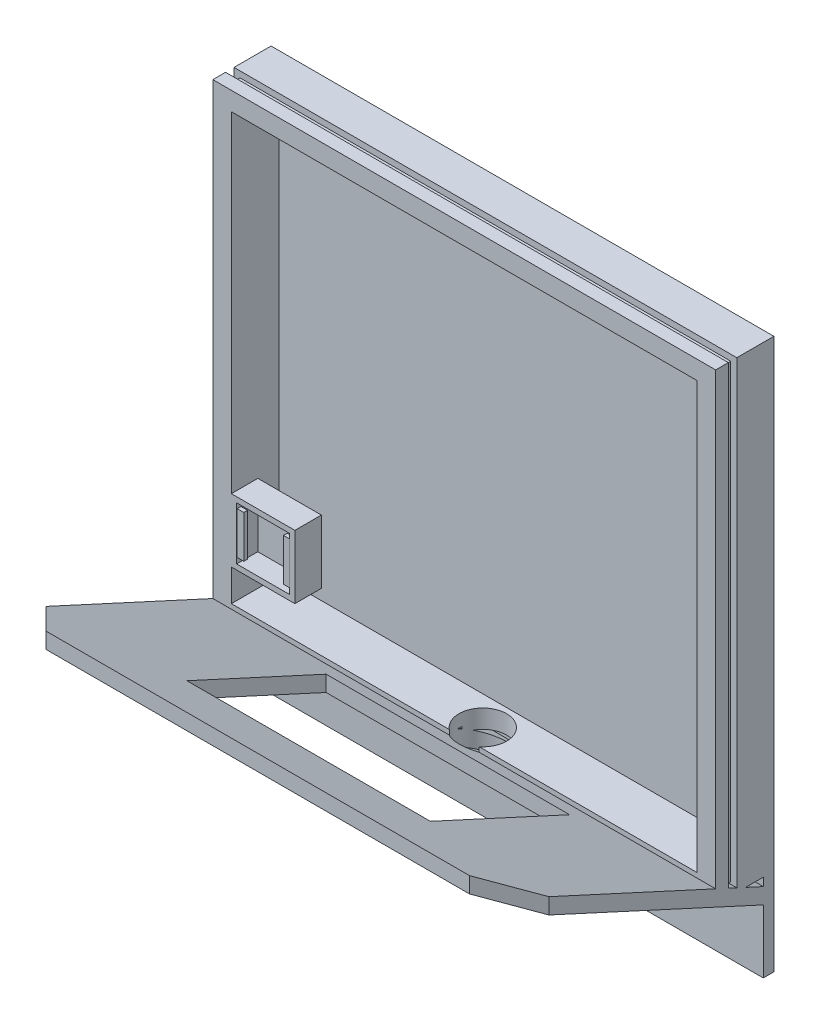
from build123d import *

# Parameters (mm, degrees)
F_190_X_200_TRAY_FLOOR_SKETCH_W                       = 190
F_190_X_200_TRAY_FLOOR_SKETCH_H                       = 208
F_4_MM_TRAY_FLOOR_DEPTH                               = 4
ELECTRONICS_COMPARTMENT_WALL_SKETCH_W                 = 190
ELECTRONICS_COMPARTMENT_WALL_SKETCH_H                 = 175
ELECTRONICS_COMPARTMENT_WALL_SKETCH_W_2               = 176
ELECTRONICS_COMPARTMENT_WALL_SKETCH_H_2               = 161
F_22_MM_PERIMETER_WALLS_DEPTH                         = 22
F_3_2_START                                           = 17.2
EXTERNAL_WALL_CORD_GASKET_GROOVE_SKETCH_W             = 192
EXTERNAL_WALL_CORD_GASKET_GROOVE_SKETCH_H             = 177
EXTERNAL_WALL_CORD_GASKET_GROOVE_SKETCH_W_2           = 185.4
EXTERNAL_WALL_CORD_GASKET_GROOVE_SKETCH_H_2           = 170.4
F_3_2_HIGH_X_2_3_DEEP_EXTERNAL_PERIMETER_G_DEPTH      = 3.2
F_24_MM_GPS_ANTENNA_SHELF_SKETCH_W                    = 24
F_24_MM_GPS_ANTENNA_SHELF_SKETCH_H                    = 24
F_2_MM_GPS_ANTENNA_SHELF_DEPTH                        = 2
F_20_MM_GPS_ANTENNA_GUIDE_RING_SKETCH_W               = 24
F_20_MM_GPS_ANTENNA_GUIDE_RING_SKETCH_H               = 24
F_20_MM_GPS_ANTENNA_GUIDE_RING_SKETCH_W_2             = 20
F_20_MM_GPS_ANTENNA_GUIDE_RING_SKETCH_H_2             = 20
F_8_5_MM_GPS_ANTENNA_GUIDE_RING_DEPTH                 = 8.5
LEFT_GPS_ANTENNA_SNAP_LIP_SKETCH_W                    = 2.5
LEFT_GPS_ANTENNA_SNAP_LIP_SKETCH_H                    = 16
LEFT_GPS_ANTENNA_SNAP_LIP_DEPTH                       = 1.4
RIGHT_GPS_ANTENNA_SNAP_LIP_SKETCH_W                   = 2.5
RIGHT_GPS_ANTENNA_SNAP_LIP_SKETCH_H                   = 16
RIGHT_GPS_ANTENNA_SNAP_LIP_DEPTH                      = 1.4
F_190_MM_WIDE_ANGLED_DISPLAY_BULKHEAD_DEPTH           = 95
F_190_MM_WIDE_ANGLED_DISPLAY_BULKHEAD_DEPTH_BACK      = 95
F_92_X_58_MM_DISPLAY_OPENING_DEPTH                    = 46
F_92_X_58_MM_DISPLAY_OPENING_DEPTH_BACK               = 46
F_18_MM_FRONT_12_V_AND_SENSOR_HARNESS_PASS_DEPTH      = 40
F_18_MM_FRONT_12_V_AND_SENSOR_HARNESS_PASS_DEPTH_BACK = 40
F_18_MM_FRONT_HARNESS_GROMMET_SKETCH_R                = 9
LEFT_SCREEN_HOLDER_CORNER_CHAMFER_DEPTH               = 110
LEFT_SCREEN_HOLDER_CORNER_CHAMFER_DEPTH_BACK          = 110
RIGHT_SCREEN_HOLDER_CORNER_CHAMFER_DEPTH              = 110
RIGHT_SCREEN_HOLDER_CORNER_CHAMFER_DEPTH_BACK         = 110


with BuildPart() as part:
    # 190 x 200 Tray Floor Sketch → 4 mm Tray Floor (new body)
    with BuildSketch(Plane.XY):
        with Locations((0, 96)):
            Rectangle(F_190_X_200_TRAY_FLOOR_SKETCH_W, F_190_X_200_TRAY_FLOOR_SKETCH_H)
    extrude(amount=F_4_MM_TRAY_FLOOR_DEPTH)

    # Electronics Compartment Wall Sketch → 22 mm Perimeter Walls (add)
    with BuildSketch(Plane.XY):
        with Locations((0, 112.5)):
            Rectangle(ELECTRONICS_COMPARTMENT_WALL_SKETCH_W, ELECTRONICS_COMPARTMENT_WALL_SKETCH_H)
        with Locations((0, 112.5)):
            Rectangle(ELECTRONICS_COMPARTMENT_WALL_SKETCH_W_2, ELECTRONICS_COMPARTMENT_WALL_SKETCH_H_2, mode=Mode.SUBTRACT)
    extrude(amount=F_22_MM_PERIMETER_WALLS_DEPTH)

    # External Wall Cord Gasket Groove Sketch → 3.2 High x 2.3 Deep External Perimeter Gasket Groove (cut)
    with BuildSketch(Plane.XY.offset(F_3_2_START)):
        with Locations((0, 112.5)):
            Rectangle(EXTERNAL_WALL_CORD_GASKET_GROOVE_SKETCH_W, EXTERNAL_WALL_CORD_GASKET_GROOVE_SKETCH_H)
        with Locations((0, 112.5)):
            Rectangle(EXTERNAL_WALL_CORD_GASKET_GROOVE_SKETCH_W_2, EXTERNAL_WALL_CORD_GASKET_GROOVE_SKETCH_H_2, mode=Mode.SUBTRACT)
    extrude(amount=-F_3_2_HIGH_X_2_3_DEEP_EXTERNAL_PERIMETER_G_DEPTH, mode=Mode.SUBTRACT)

    # 24 mm GPS Antenna Shelf Sketch → 2 mm GPS Antenna Shelf (add)
    with BuildSketch(Plane.XY.offset(12)):
        with Locations((-76, 56)):
            Rectangle(F_24_MM_GPS_ANTENNA_SHELF_SKETCH_W, F_24_MM_GPS_ANTENNA_SHELF_SKETCH_H)
    extrude(amount=F_2_MM_GPS_ANTENNA_SHELF_DEPTH)

    # 20 mm GPS Antenna Guide Ring Sketch → 8.5 mm GPS Antenna Guide Ring (add)
    with BuildSketch(Plane.XY.offset(13.5)):
        with Locations((-76, 56)):
            Rectangle(F_20_MM_GPS_ANTENNA_GUIDE_RING_SKETCH_W, F_20_MM_GPS_ANTENNA_GUIDE_RING_SKETCH_H)
        with Locations((-76, 56)):
            Rectangle(F_20_MM_GPS_ANTENNA_GUIDE_RING_SKETCH_W_2, F_20_MM_GPS_ANTENNA_GUIDE_RING_SKETCH_H_2, mode=Mode.SUBTRACT)
    extrude(amount=F_8_5_MM_GPS_ANTENNA_GUIDE_RING_DEPTH)

    # Left GPS Antenna Snap Lip Sketch → Left GPS Antenna Snap Lip (add)
    with BuildSketch(Plane.XY.offset(20.4)):
        with Locations((-84.75, 56)):
            Rectangle(LEFT_GPS_ANTENNA_SNAP_LIP_SKETCH_W, LEFT_GPS_ANTENNA_SNAP_LIP_SKETCH_H)
    extrude(amount=LEFT_GPS_ANTENNA_SNAP_LIP_DEPTH)

    # Right GPS Antenna Snap Lip Sketch → Right GPS Antenna Snap Lip (add)
    with BuildSketch(Plane.XY.offset(20.4)):
        with Locations((-67.25, 56)):
            Rectangle(RIGHT_GPS_ANTENNA_SNAP_LIP_SKETCH_W, RIGHT_GPS_ANTENNA_SNAP_LIP_SKETCH_H)
    extrude(amount=RIGHT_GPS_ANTENNA_SNAP_LIP_DEPTH)

    # Angled Display Bulkhead Side Profile → 190 mm Wide Angled Display Bulkhead (add, two sides: drawn at the far end of the back side and taken through both)
    with BuildSketch(Plane(origin=(0, 0, 0), x_dir=(0, 0, -1), z_dir=(1, 0, 0)).offset(-F_190_MM_WIDE_ANGLED_DISPLAY_BULKHEAD_DEPTH_BACK)):
        Polygon((-2, 15), (-2, 21), (-100, 66), (-100, 60), align=None)
    extrude(amount=F_190_MM_WIDE_ANGLED_DISPLAY_BULKHEAD_DEPTH + F_190_MM_WIDE_ANGLED_DISPLAY_BULKHEAD_DEPTH_BACK)

    # 92 x 58 Display Opening Side Profile → 92 x 58 mm Display Opening (cut, two sides: drawn at the far end of the back side and taken through both)
    with BuildSketch(Plane(origin=(0, 0, 0), x_dir=(0, 0, -1), z_dir=(1, 0, 0)).offset(-F_92_X_58_MM_DISPLAY_OPENING_DEPTH_BACK)):
        Polygon((-28.2, 25), (-28.2, 35), (-80.8, 59.2), (-80.8, 49.2), align=None)
    extrude(amount=F_92_X_58_MM_DISPLAY_OPENING_DEPTH + F_92_X_58_MM_DISPLAY_OPENING_DEPTH_BACK, mode=Mode.SUBTRACT)

    # 18 mm Front Harness Grommet Sketch → 18 mm Front 12 V and Sensor Harness Passage (cut, two sides: drawn at the far end of the back side and taken through both)
    with BuildSketch(Plane(origin=(0, 0, 0), x_dir=(1, 0, 0), z_dir=(0, 1, 0)).offset(-F_18_MM_FRONT_12_V_AND_SENSOR_HARNESS_PASS_DEPTH_BACK)):
        with Locations(Location((0, -15, 0), (0, 0, 90))):
            Circle(F_18_MM_FRONT_HARNESS_GROMMET_SKETCH_R)
    extrude(amount=F_18_MM_FRONT_12_V_AND_SENSOR_HARNESS_PASS_DEPTH + F_18_MM_FRONT_12_V_AND_SENSOR_HARNESS_PASS_DEPTH_BACK, mode=Mode.SUBTRACT)

    # Left Screen Holder Corner Chamfer Sketch → Left Screen Holder Corner Chamfer (cut, two sides: drawn at the far end of the back side and taken through both)
    with BuildSketch(Plane(origin=(0, 0, 0), x_dir=(1, 0, 0), z_dir=(0, 1, 0)).offset(-LEFT_SCREEN_HOLDER_CORNER_CHAMFER_DEPTH_BACK)):
        Polygon((-95, -100), (-80, -100), (-95, -85), align=None)
    extrude(amount=LEFT_SCREEN_HOLDER_CORNER_CHAMFER_DEPTH + LEFT_SCREEN_HOLDER_CORNER_CHAMFER_DEPTH_BACK, mode=Mode.SUBTRACT)

    # Right Screen Holder Corner Chamfer Sketch → Right Screen Holder Corner Chamfer (cut, two sides: drawn at the far end of the back side and taken through both)
    with BuildSketch(Plane(origin=(0, 0, 0), x_dir=(1, 0, 0), z_dir=(0, 1, 0)).offset(-RIGHT_SCREEN_HOLDER_CORNER_CHAMFER_DEPTH_BACK)):
        Polygon((95, -100), (80, -100), (95, -85), align=None)
    extrude(amount=RIGHT_SCREEN_HOLDER_CORNER_CHAMFER_DEPTH + RIGHT_SCREEN_HOLDER_CORNER_CHAMFER_DEPTH_BACK, mode=Mode.SUBTRACT)


solid = part.part
